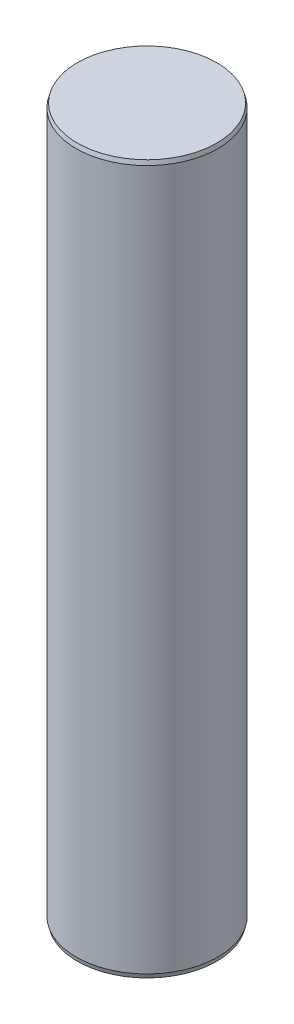
from build123d import *


with BuildPart() as part:
    # Esquisse1 → Base-Révolution (revolve)
    with BuildSketch(Plane.XY, mode=Mode.PRIVATE) as base_r_volution_sk:
        Polygon((2, -19.88), (2, -0.12), (1.967846097, 0), (0, 0), (0, -20), (1.967846097, -20), align=None)
    revolve(base_r_volution_sk.sketch.rotate(Axis((0, 0, 0), (0, 1, 0)), 90), axis=Axis((0, 0, 0), (0, 1, 0)))


solid = part.part
